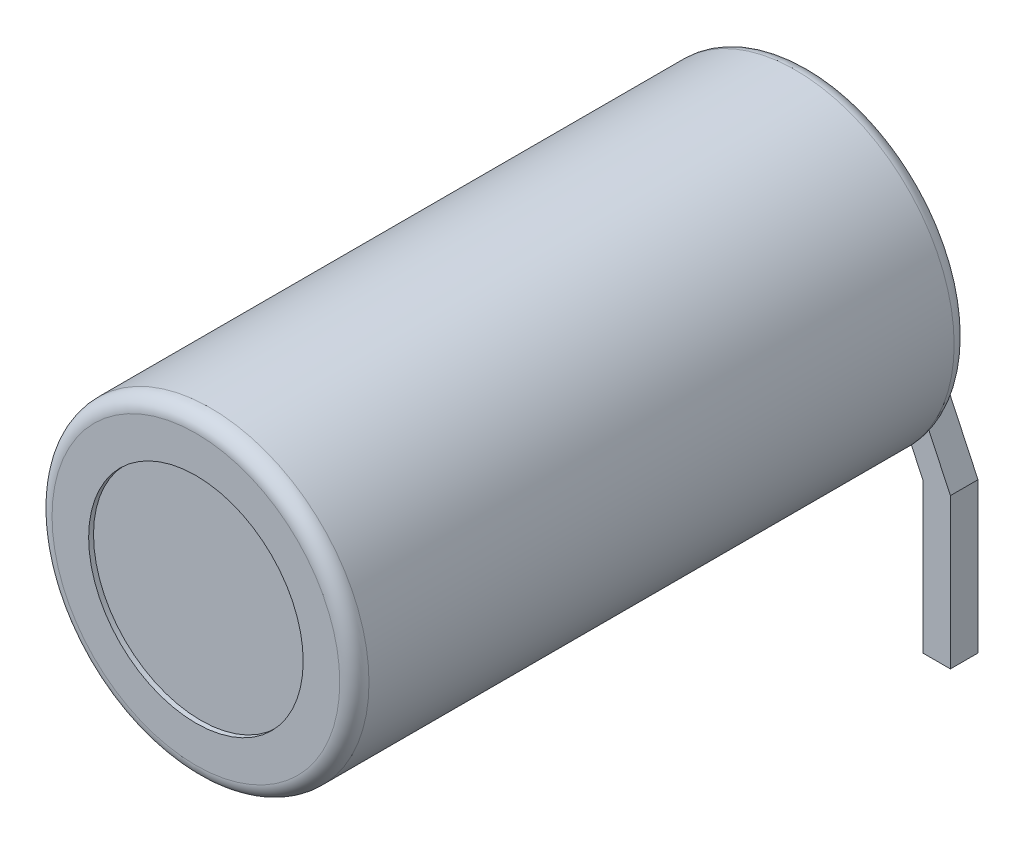
from build123d import *

# Parameters (mm, degrees)
BOSS_EXTRUDE1_DEPTH   = 0.566
BOSS_EXTRUDE1_2_DEPTH = 0.566
SKETCH4_W             = 0.566
SKETCH4_H             = 0.566
BOSS_EXTRUDE2_DEPTH   = 0.716
CHAMFER1_SIZE         = 0.2


with BuildPart() as part:
    # Sketch1 → Revolve1 (revolve)
    with BuildSketch(Plane(origin=(0, 0, 0), x_dir=(0, 0, -1), z_dir=(1, 0, 0)), mode=Mode.PRIVATE) as revolve1_sk:
        with BuildLine():
            ThreePointArc((-6.3, 0.4), (-6.212132034, 0.187867966), (-6, 0.1))
            Line((-6, 0.1), (6, 0.1))
            ThreePointArc((6, 0.1), (6.212132034, 0.187867966), (6.3, 0.4))
            Line((6.3, 0.4), (6.3, 1.15))
            Line((6.3, 1.15), (6.2, 1.15))
            Line((6.2, 1.15), (6.2, 0.4))
            ThreePointArc((6.2, 0.4), (6.141421356, 0.258578644), (6, 0.2))
            Line((6, 0.2), (-6, 0.2))
            ThreePointArc((-6, 0.2), (-6.141421356, 0.258578644), (-6.2, 0.4))
            Line((-6.2, 0.4), (-6.2, 1.15))
            Line((-6.2, 1.15), (-6.3, 1.15))
            Line((-6.3, 1.15), (-6.3, 0.4))
        make_face()
    revolve(revolve1_sk.sketch.rotate(Axis((0, 3.35, 8.510583283), (0, 0, -1)), 270), axis=Axis((0, 3.35, 8.510583283), (0, 0, -1)))


with BuildPart() as body_2:
    # Sketch1<4> → Revolve2 (revolve)
    with BuildSketch(Plane(origin=(0, 0, 0), x_dir=(0, 0, -1), z_dir=(1, 0, 0))):
        with BuildLine():
            Line((-6.2, 3.35), (-6.2, 1.15))
            Line((-6.2, 1.15), (-6.2, 0.4))
            ThreePointArc((-6.2, 0.4), (-6.141421356, 0.258578644), (-6, 0.2))
            Line((-6, 0.2), (6, 0.2))
            ThreePointArc((6, 0.2), (6.141421356, 0.258578644), (6.2, 0.4))
            Line((6.2, 0.4), (6.2, 1.15))
            Line((6.2, 1.15), (6.2, 3.35))
            Line((6.2, 3.35), (-6.2, 3.35))
        make_face()
    revolve(axis=Axis((0, 3.35, 8.510583283), (0, 0, -1)))



with BuildPart() as body_3:
    # Sketch3 → Boss-Extrude1 (new body)
    with BuildSketch(Plane(origin=(0, 0, -6.35), x_dir=(-1, 0, 0), z_dir=(0, 0, -1))):
        Polygon((2.257, -3), (2.257, 0.278543307), (1.217, 2.5), (1.783, 2.5), (2.823, 0.278543307), (2.823, -3), align=None)
    extrude(amount=BOSS_EXTRUDE1_DEPTH)


with BuildPart() as body_4:
    # Sketch3 → Boss-Extrude1 2 (new body)
    with BuildSketch(Plane(origin=(0, 0, -6.35), x_dir=(-1, 0, 0), z_dir=(0, 0, -1))):
        Polygon((-2.823, 0.278543307), (-1.783, 2.5), (-1.217, 2.5), (-2.257, 0.278543307), (-2.257, -3), (-2.823, -3), align=None)
    extrude(amount=BOSS_EXTRUDE1_2_DEPTH)


with BuildPart() as body_2_1:
    add(body_2.part)

    add(body_3.part)  # Boss-Extrude2 merges body 3

    add(body_4.part)  # Boss-Extrude2 merges body 4
    # Sketch4 → Boss-Extrude2 (add)
    with BuildSketch(Plane(origin=(0, 0, -6.2), x_dir=(-1, 0, 0), z_dir=(0, 0, -1))):
        with Locations((-1.5, 2.783)):
            Rectangle(SKETCH4_W, SKETCH4_H)
        with Locations((1.5, 2.783)):
            Rectangle(SKETCH4_W, SKETCH4_H)
    extrude(amount=BOSS_EXTRUDE2_DEPTH)

    # Chamfer1
    chamfer1_edges = [body_2_1.edges().sort_by_distance(p)[0] for p in [
        (2.54, -3, -6.35),
        (2.823, -3, -6.633),
        (2.257, -3, -6.633),
        (2.54, -3, -6.916),
        (-2.54, -3, -6.35),
        (-2.257, -3, -6.633),
        (-2.823, -3, -6.633),
        (-2.54, -3, -6.916),
    ]]
    chamfer(chamfer1_edges, length=CHAMFER1_SIZE)


solid = Compound([part.part, body_2_1.part])
